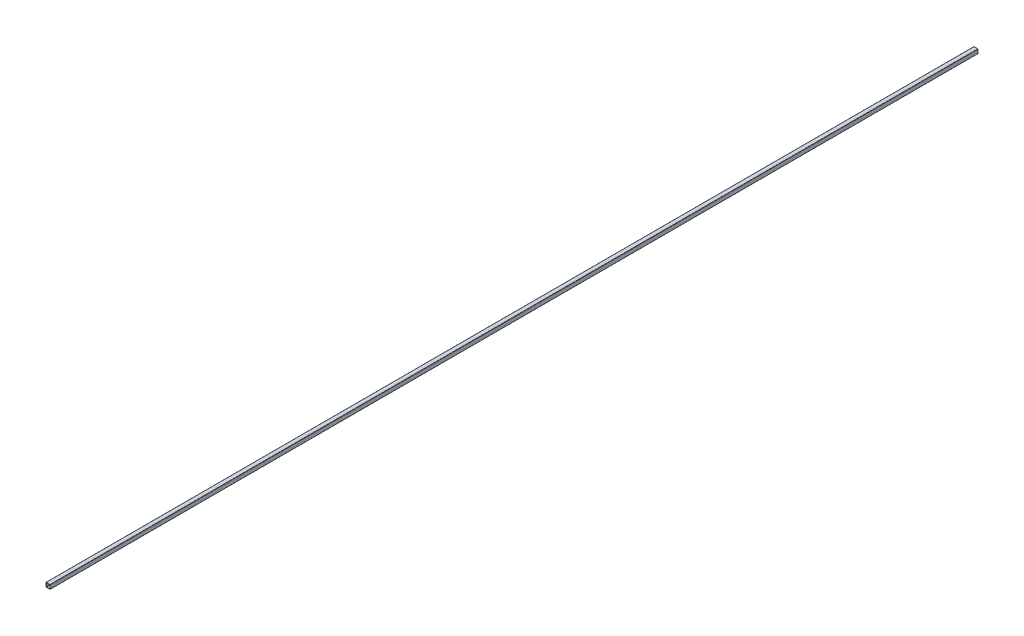
from build123d import *

# Parameters (mm, degrees)
BOSS_EXTRUDE1_DEPTH = 8380


with BuildPart() as part:
    # Sketch1 → Boss-Extrude1 (new body)
    with BuildSketch(Plane.XY):
        with BuildLine():
            Line((2.54, 0), (35.56, 0))
            ThreePointArc((35.56, 0), (37.356051224, -0.743948776), (38.1, -2.54))
            Line((38.1, -2.54), (38.1, -35.56))
            ThreePointArc((38.1, -35.56), (37.356051224, -37.356051224), (35.56, -38.1))
            Line((35.56, -38.1), (2.54, -38.1))
            ThreePointArc((2.54, -38.1), (0.743948776, -37.356051224), (0, -35.56))
            Line((0, -35.56), (0, -2.54))
            ThreePointArc((0, -2.54), (0.743948776, -0.743948776), (2.54, 0))
        make_face()
        with BuildLine():
            Line((5.3086, -2.7686), (32.7914, -2.7686))
            ThreePointArc((32.7914, -2.7686), (34.587451224, -3.512548776), (35.3314, -5.3086))
            Line((35.3314, -5.3086), (35.3314, -32.7914))
            ThreePointArc((35.3314, -32.7914), (34.587451224, -34.587451224), (32.7914, -35.3314))
            Line((32.7914, -35.3314), (5.3086, -35.3314))
            ThreePointArc((5.3086, -35.3314), (3.512548776, -34.587451224), (2.7686, -32.7914))
            Line((2.7686, -32.7914), (2.7686, -5.3086))
            ThreePointArc((2.7686, -5.3086), (3.512548776, -3.512548776), (5.3086, -2.7686))
        make_face(mode=Mode.SUBTRACT)
    extrude(amount=BOSS_EXTRUDE1_DEPTH)


solid = part.part
